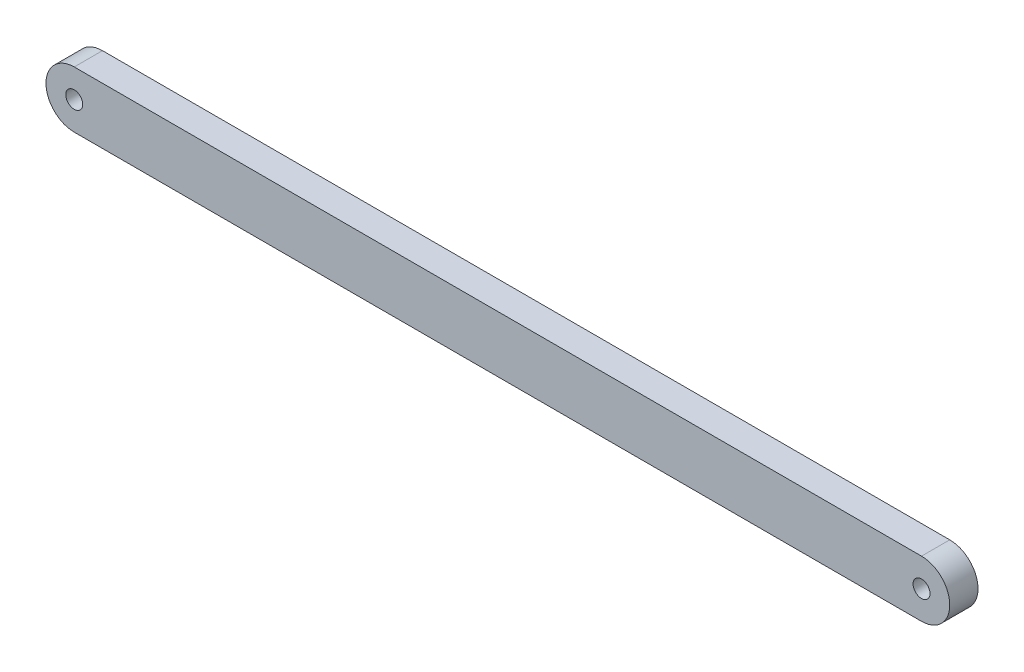
from build123d import *

# Parameters (mm, degrees)
ESQUISSE1_R        = 1.5
BOSS_EXTRU_1_DEPTH = 5


with BuildPart() as part:
    # Esquisse1 → Boss.-Extru.1 (new body)
    with BuildSketch(Plane.XY):
        with BuildLine():
            Line((-75, 5), (75, 5))
            ThreePointArc((75, 5), (80, 0), (75, -5))
            Line((75, -5), (-75, -5))
            ThreePointArc((-75, -5), (-80, 0), (-75, 5))
        make_face()
        with Locations((-75, 0)):
            Circle(ESQUISSE1_R, mode=Mode.SUBTRACT)
        with Locations((75, 0)):
            Circle(ESQUISSE1_R, mode=Mode.SUBTRACT)
    extrude(amount=BOSS_EXTRU_1_DEPTH)


solid = part.part
